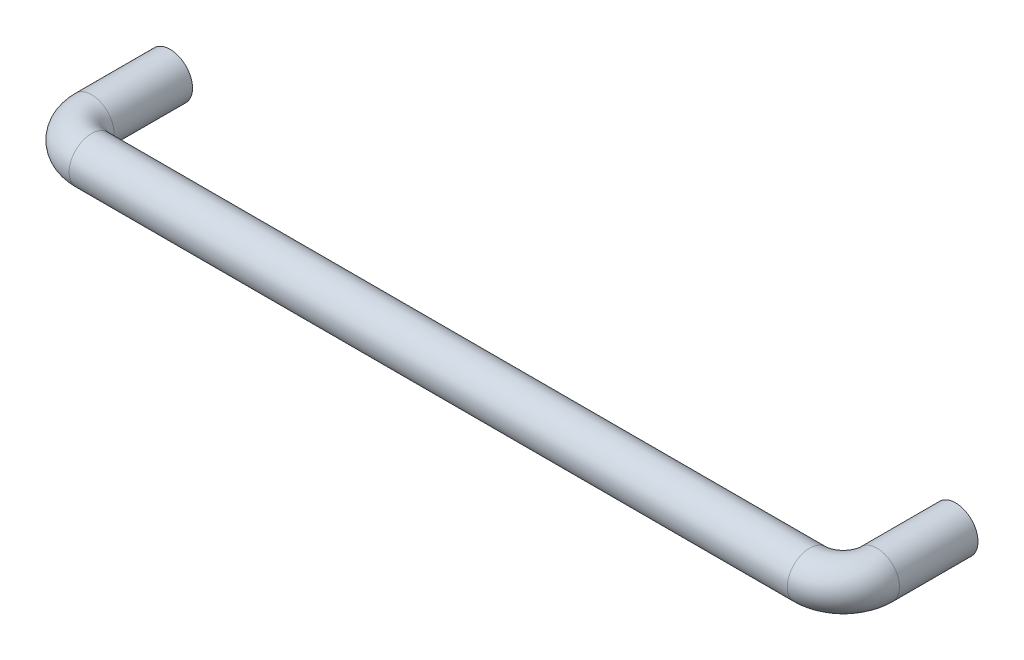
from build123d import *

# Parameters (mm, degrees)
SKETCH2_R = 1


with BuildPart() as part:
    # Sweep1: sweep along a path in Sketch1
    with BuildLine(Plane(origin=(0, 0, 0), x_dir=(1, 0, 0), z_dir=(0, 1, 0))) as sweep1_path:
        Line((0, 0), (0, -3.5))
        ThreePointArc((0, -3.5), (-0.439339828, -4.560660172), (-1.5, -5))
        Line((-1.5, -5), (-33.5, -5))
        ThreePointArc((-33.5, -5), (-34.560660172, -4.560660172), (-35, -3.5))
        Line((-35, -3.5), (-35, 0))
    # Sketch2 → Sweep1 (sweep)
    with BuildSketch(Plane.XY):
        Circle(SKETCH2_R)
    sweep(path=sweep1_path.line)


solid = part.part
